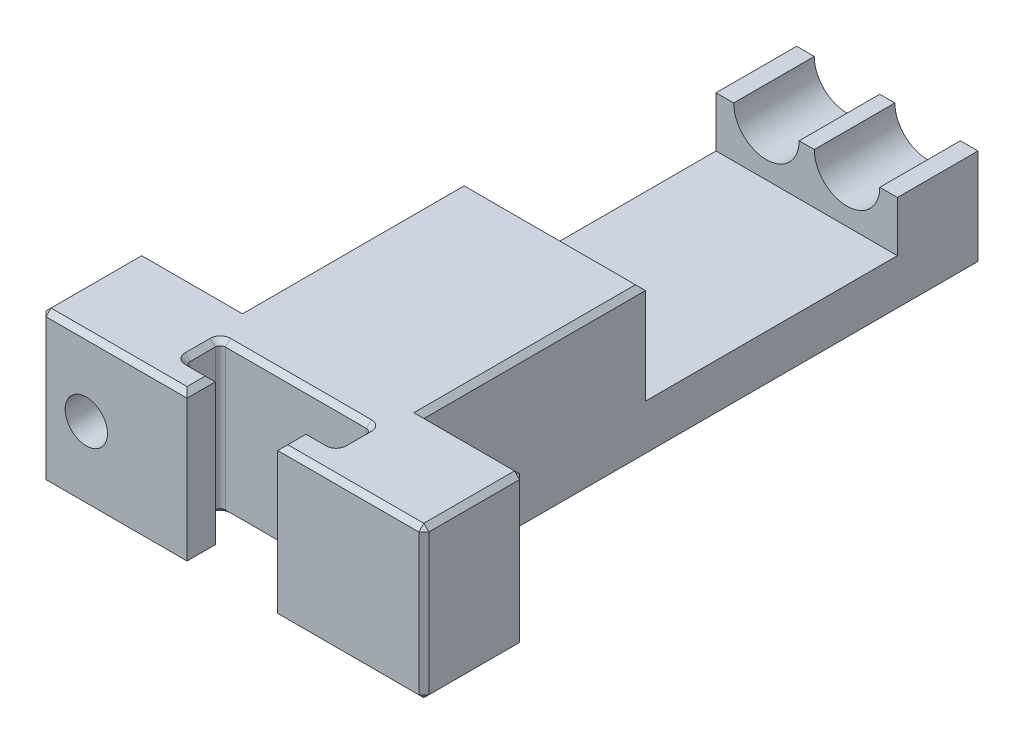
from build123d import *

# Parameters (mm, degrees)
SKETCH_1_W             = 18
SKETCH_1_H             = 10
EXTRUDE_1_DEPTH        = 65
SKETCH_2_W             = 25
SKETCH_2_H             = 5
CUT_EXTRUDE_1_DEPTH    = 69.183575735
SKETCH_3_W             = 18
SKETCH_3_H             = 32
EXTRUDE_2_DEPTH        = 5
SKETCH_4_W             = 38
SKETCH_4_H             = 10
EXTRUDE_3_DEPTH        = 15
HOLE_WIZARD_M5_1_D     = 4.2
PATTERN_LINEAR_2_COUNT = 2
PATTERN_LINEAR_2_PITCH = 8
CUT_EXTRUDE_2_DEPTH    = 73.346388991
CHAMFER_1_SIZE         = 0.5
SKETCH_10_W            = 12
SKETCH_10_H            = 77.617391284
CUT_EXTRUDE_3_DEPTH    = 0.5


with BuildPart() as part:
    # 草图1 → 凸台-拉伸1 (new body)
    with BuildSketch(Plane.XY):
        with Locations((9, 5)):
            Rectangle(SKETCH_1_W, SKETCH_1_H)
    extrude(amount=EXTRUDE_1_DEPTH)

    # 草图2 → 切除-拉伸1 (cut, through all)
    with BuildSketch(Plane.ZY):
        with Locations((20.5, 7.5)):
            Rectangle(SKETCH_2_W, SKETCH_2_H)
    extrude(amount=-CUT_EXTRUDE_1_DEPTH, mode=Mode.SUBTRACT)

    # 草图3 → 凸台-拉伸2 (add)
    with BuildSketch(Plane(origin=(0, 10, 0), x_dir=(1, 0, 0), z_dir=(0, 1, 0))):
        with Locations((9, -49)):
            Rectangle(SKETCH_3_W, SKETCH_3_H)
    extrude(amount=EXTRUDE_2_DEPTH)

    # 草图4 → 凸台-拉伸3 (add)
    with BuildSketch(Plane(origin=(0, 15, 0), x_dir=(1, 0, 0), z_dir=(0, 1, 0))):
        with Locations((9, -60)):
            Rectangle(SKETCH_4_W, SKETCH_4_H)
    extrude(amount=-EXTRUDE_3_DEPTH)

    # M5 螺纹孔1 (through all)
    with Locations(Plane.XY.offset(65)):
        with Locations((-5.5, 7.5)):
            Hole(HOLE_WIZARD_M5_1_D / 2)

    # 草图7 → Ø6.5 (6.5) 直径孔1 (revolve, cut)
    with BuildSketch(Plane(origin=(13, 10, 0), x_dir=(0, 1, 0), z_dir=(1, 0, 0))):
        Polygon((0, 0), (0, 41.952797012), (3.25, 40), (3.25, 0), align=None)
    hole_wizard_6_5_6_5_1 = revolve(axis=Axis((13, 10, -6.35), (0, 0, 1)), mode=Mode.SUBTRACT)

    # 阵列(线性)2: Ø6.5 (6.5) 直径孔1 ×2
    with Locations(*[(-i * PATTERN_LINEAR_2_PITCH, 0, 0) for i in range(1, PATTERN_LINEAR_2_COUNT)]):
        add(hole_wizard_6_5_6_5_1, mode=Mode.SUBTRACT)

    # 草图9 → 切除-拉伸2 (cut, through all)
    with BuildSketch(Plane(origin=(0, 15, 0), x_dir=(1, 0, 0), z_dir=(0, 1, 0))):
        with BuildLine():
            Line((13.5, -65), (4.5, -65))
            Line((4.5, -65), (4.5, -62.2))
            Line((4.5, -62.2), (2, -62.2))
            ThreePointArc((2, -62.2), (1.646446609, -62.053553391), (1.5, -61.7))
            Line((1.5, -61.7), (1.5, -59.2))
            ThreePointArc((1.5, -59.2), (1.646446609, -58.846446609), (2, -58.7))
            Line((2, -58.7), (16, -58.7))
            ThreePointArc((16, -58.7), (16.353553391, -58.846446609), (16.5, -59.2))
            Line((16.5, -59.2), (16.5, -61.7))
            ThreePointArc((16.5, -61.7), (16.353553391, -62.053553391), (16, -62.2))
            Line((16, -62.2), (13.5, -62.2))
            Line((13.5, -62.2), (13.5, -65))
        make_face()
    extrude(amount=-CUT_EXTRUDE_2_DEPTH, mode=Mode.SUBTRACT)

    # 倒角1
    chamfer_1_edges = [part.edges().sort_by_distance(p)[0] for p in [
        (20.75, 15, 65),
        (20.75, 0, 65),
        (13.5, 0, 63.6),
        (4.5, 0, 63.6),
        (3.25, 0, 62.2),
        (1.646446609, 0, 62.053553391),
        (1.5, 0, 60.45),
        (1.646446609, 0, 58.846446609),
        (9, 0, 58.7),
        (16.353553391, 0, 58.846446609),
        (16.5, 0, 60.45),
        (16.353553391, 0, 62.053553391),
        (14.75, 0, 62.2),
        (13.5, 15, 63.6),
        (14.75, 15, 62.2),
        (16.353553391, 15, 62.053553391),
        (16.5, 15, 60.45),
        (16.353553391, 15, 58.846446609),
        (9, 15, 58.7),
        (1.646446609, 15, 58.846446609),
        (1.5, 15, 60.45),
        (1.646446609, 15, 62.053553391),
        (3.25, 15, 62.2),
        (4.5, 15, 63.6),
        (9, 15, 33),
        (0, 15, 44),
        (-2.75, 15, 65),
        (18, 15, 44),
        (18, 0, 27.5),
        (0, 0, 27.5),
        (-5, 15, 55),
        (-10, 15, 60),
        (23, 15, 55),
        (28, 15, 60),
        (-5, 0, 55),
        (-10, 0, 60),
        (23, 0, 55),
        (28, 0, 60),
        (-10, 7.5, 55),
        (28, 7.5, 65),
        (-10, 7.5, 65),
        (28, 7.5, 55),
        (9, 0, 0),
        (-2.75, 0, 65),
    ]]
    chamfer(chamfer_1_edges, length=CHAMFER_1_SIZE)

    # 草图10 → 切除-拉伸3 (cut)
    with BuildSketch(Plane.XZ):
        with Locations((9, 33.316007813)):
            Rectangle(SKETCH_10_W, SKETCH_10_H)
    extrude(amount=-CUT_EXTRUDE_3_DEPTH, mode=Mode.SUBTRACT)


solid = part.part
